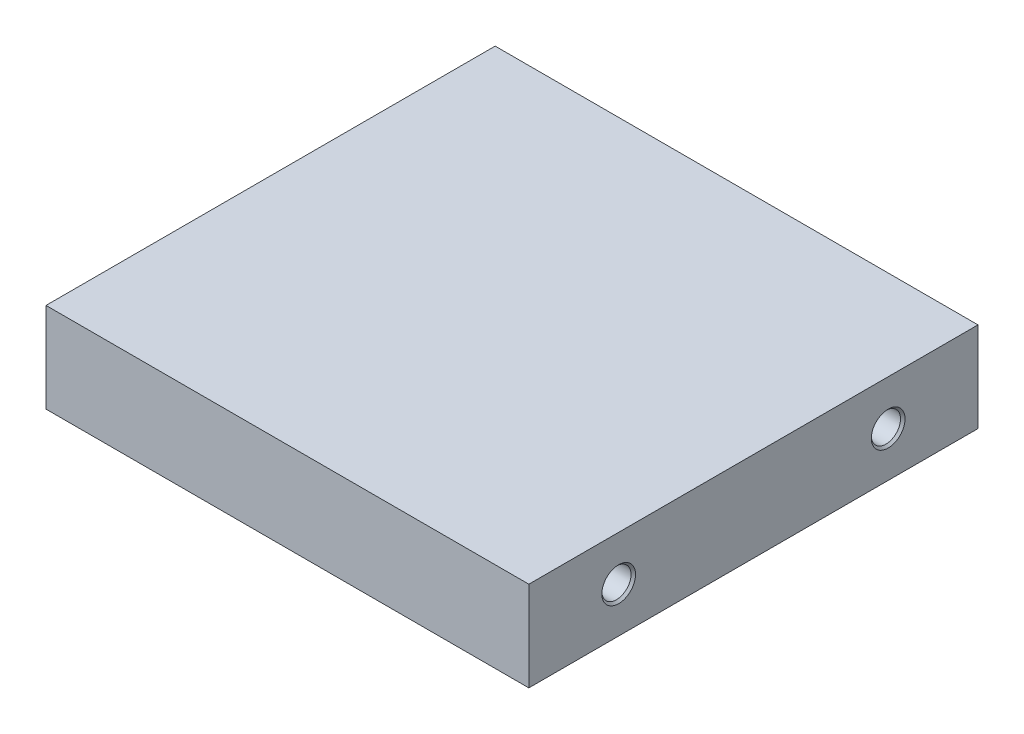
from build123d import *

# Parameters (mm, degrees)
SKETCH_1_W          = 43
SKETCH_1_H          = 40
EXTRUDE_1_DEPTH     = 8
SKETCH_2_R          = 1.3
CUT_EXTRUDE_1_DEPTH = 8
CHAMFER_1_SIZE      = 0.2


with BuildPart() as part:
    # 草圖1 → 填料-伸長1 (new body)
    with BuildSketch(Plane(origin=(0, 0, 0), x_dir=(1, 0, 0), z_dir=(0, 1, 0))):
        Rectangle(SKETCH_1_W, SKETCH_1_H)
    extrude(amount=EXTRUDE_1_DEPTH)

    # 草圖2 → 除料-伸長1 (cut)
    with BuildSketch(Plane.ZY.offset(21.5)):
        with Locations((-12, 4)):
            Circle(SKETCH_2_R)
        with Locations((12, 4)):
            Circle(SKETCH_2_R)
    cut_extrude_1 = extrude(amount=-CUT_EXTRUDE_1_DEPTH, mode=Mode.SUBTRACT)

    # 鏡射1: 除料-伸長1 across plane
    add(cut_extrude_1.mirror(Plane(origin=(0, 0, 0), x_dir=(0, 0, 1), z_dir=(1, 0, 0))), mode=Mode.SUBTRACT)

    # 導角1
    chamfer_1_edges = [part.edges().sort_by_distance(p)[0] for p in [
        (-21.5, 4, -13.3),
        (-21.5, 4, 10.7),
        (21.5, 4, -13.3),
        (21.5, 4, 10.7),
    ]]
    chamfer(chamfer_1_edges, length=CHAMFER_1_SIZE)


solid = part.part
